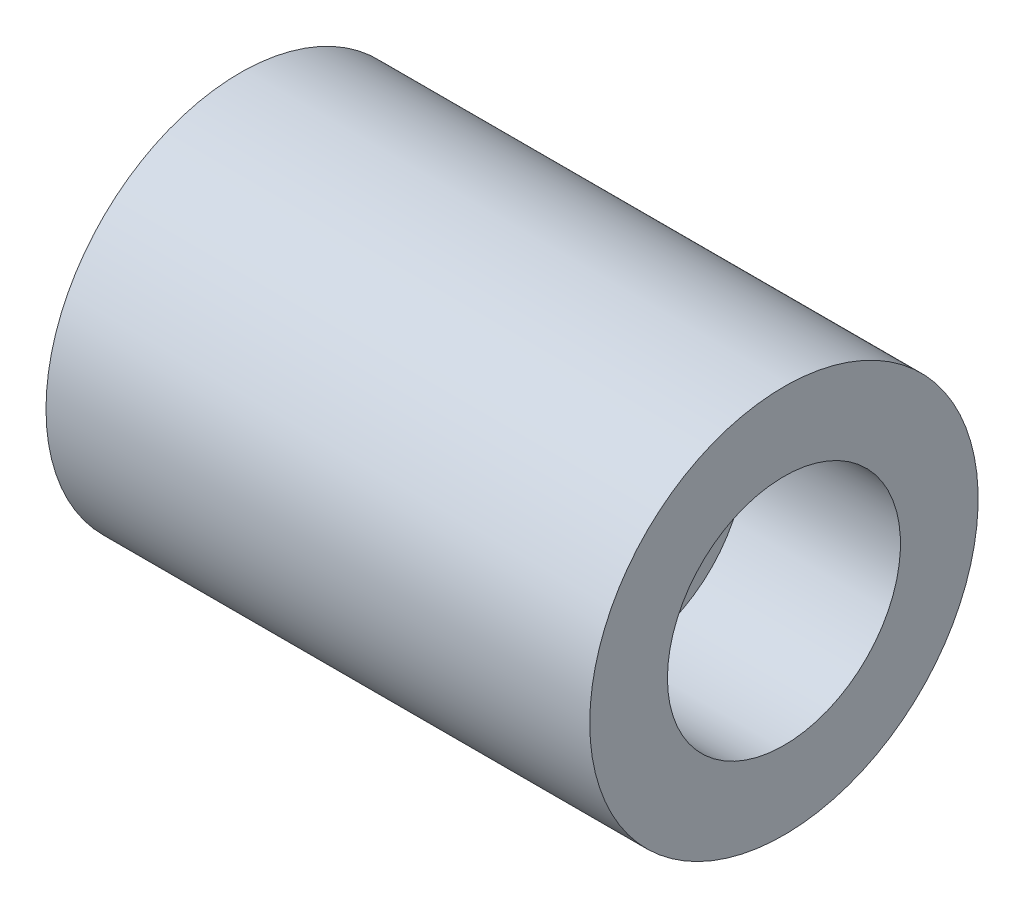
from build123d import *

# Parameters (mm, degrees)
SKETCH_1_W   = 40
SKETCH_1_H   = 20
SKETCH_1_W_2 = 20
SKETCH_1_H_2 = 50


with BuildPart() as part:
    # 草圖1 → 旋轉1 (revolve)
    with BuildSketch(Plane.XY, mode=Mode.PRIVATE) as revolve_1_sk:
        with Locations((120, 40)):
            Rectangle(SKETCH_1_W, SKETCH_1_H)
        Polygon((20, 50), (20, 10), (100, 10), (100, 30), (100, 50), align=None)
        with Locations((10, 25)):
            Rectangle(SKETCH_1_W_2, SKETCH_1_H_2)
    revolve(revolve_1_sk.sketch.rotate(Axis((0, 0, 0), (1, 0, 0)), 90), axis=Axis((0, 0, 0), (1, 0, 0)))


solid = part.part
